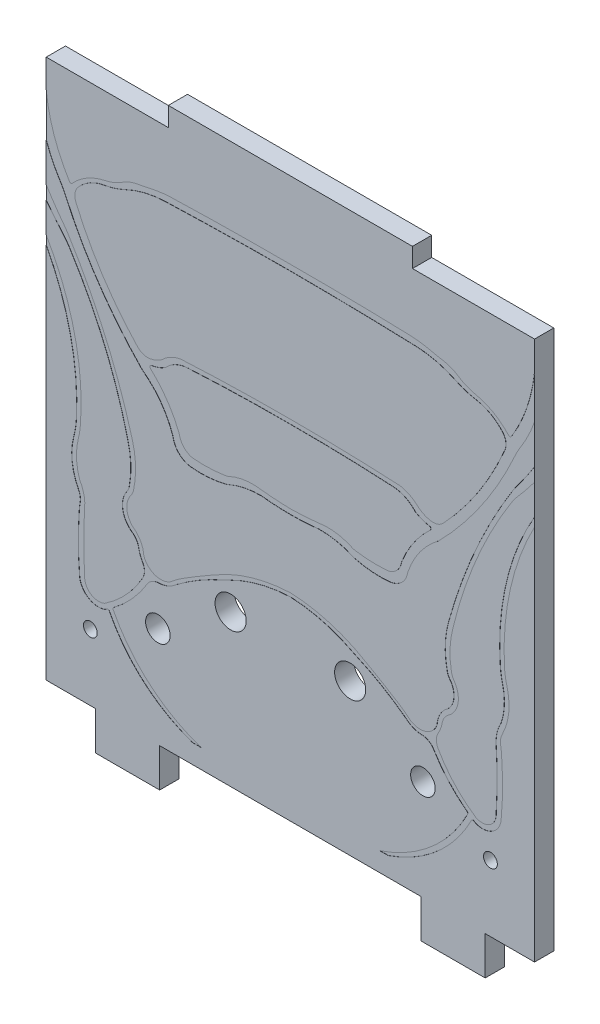
from build123d import *

# Parameters (mm, degrees)
SKETCH_1_W          = 76.2
SKETCH_1_H          = 84.2
EXTRUDE_1_DEPTH     = 3
SKETCH_2_R          = 2.428209478
SKETCH_2_R_2        = 1.917015623
SKETCH_2_R_3        = 1.077135338
CUT_EXTRUDE_2_DEPTH = 0.025
CUT_EXTRUDE_START   = 3
SKETCH_4_R          = 1.077135338
SKETCH_4_R_2        = 1.917015623
SKETCH_4_R_3        = 2.428209478
CUT_EXTRUDE_7_DEPTH = 3
SKETCH_5_W          = 10
SKETCH_5_H          = 3
EXTRUDE_2_DEPTH     = 3
SKETCH_7_W          = 10
SKETCH_7_H          = 3
EXTRUDE_3_DEPTH     = 3
SKETCH_8_W          = 38.1
SKETCH_8_H          = 3
EXTRUDE_4_DEPTH     = 3


with BuildPart() as part:
    # 스케치1 → 보스-돌출1 (new body)
    with BuildSketch(Plane.XY):
        Rectangle(SKETCH_1_W, SKETCH_1_H)
    extrude(amount=EXTRUDE_1_DEPTH)

    # 스케치2 → 컷-돌출2 (cut)
    # profile 1 of 8: a face of its own
    with BuildSketch(Plane.XY.offset(3)):
        with Locations((9.327829639, -18.496567926)):
            Circle(SKETCH_2_R)
    # profile 2 of 8: a face of its own
    with BuildSketch(Plane.XY.offset(3)):
        with Locations((20.679674422, -26.41933731)):
            Circle(SKETCH_2_R_2)
    # profile 3 of 8: a face of its own
    with BuildSketch(Plane.XY.offset(3)):
        with Locations((31.215777243, -31.768084931)):
            Circle(SKETCH_2_R_3)
    # profile 4 of 8: a face of its own
    with BuildSketch(Plane.XY.offset(3)):
        with Locations(Location((-31.215777243, -31.768084931, 0), (0, 0, 180))):
            Circle(SKETCH_2_R_3)
    # profile 5 of 8: a face of its own
    with BuildSketch(Plane.XY.offset(3)):
        with Locations(Location((-20.679674422, -26.41933731, 0), (0, 0, 180))):
            Circle(SKETCH_2_R_2)
    # profile 6 of 8: a face of its own
    with BuildSketch(Plane.XY.offset(3)):
        with Locations(Location((-9.327829639, -18.496567926, 0), (0, 0, 180))):
            Circle(SKETCH_2_R)
    # profile 7 of 8: a face of its own
    with BuildSketch(Plane.XY.offset(3)):
        with BuildLine():
            Line((13.934162196, -39.12111864), (15.263541272, -39.12111864))
            ThreePointArc((15.263541272, -39.12111864), (22.865645143, -34.759396313), (28.262399999, -27.853482765))
            ThreePointArc((28.262399999, -27.853482765), (28.423488973, -27.723083039), (28.62809542, -27.756097399))
            ThreePointArc((28.62809542, -27.756097399), (28.797135117, -27.865708412), (28.967249862, -27.973643426))
            ThreePointArc((28.967249862, -27.973643426), (31.490380119, -27.721302262), (32.881730928, -25.601395357))
            ThreePointArc((32.881730928, -25.601395357), (33.108744036, -21.079343328), (32.950754552, -16.554353956))
            ThreePointArc((32.950754552, -16.554353956), (32.895980591, -16.00403951), (32.817300277, -15.45663145))
            ThreePointArc((32.817300277, -15.45663145), (32.813206672, -14.608618837), (33.075597067, -13.802211104))
            ThreePointArc((33.075597067, -13.802211104), (34.070130402, -10.477777222), (33.804918268, -7.017918884))
            ThreePointArc((33.804918268, -7.017918884), (33.527781174, -5.698147131), (33.39214944, -4.356429395))
            ThreePointArc((33.39214944, -4.356429395), (34.713431323, 8.054397039), (39.727850627, 19.483745124))
            Line((39.727850627, 19.483745124), (41.992619893, 23.55575662))
            ThreePointArc((41.992619893, 23.55575662), (34.600568834, 10.267079087), (32.755117617, -4.826816342))
            ThreePointArc((32.755117617, -4.826816342), (32.879713892, -5.911777007), (33.097060574, -6.982021977))
            ThreePointArc((33.097060574, -6.982021977), (33.375678952, -9.708481541), (32.881730928, -12.404260705))
            ThreePointArc((32.881730928, -12.404260705), (32.233999273, -14.014722003), (32.09318724, -15.744841613))
            ThreePointArc((32.09318724, -15.744841613), (32.253303205, -20.095129768), (32.129656743, -24.446607185))
            ThreePointArc((32.129656743, -24.446607185), (32.112565855, -24.813551729), (32.106094728, -25.180837069))
            ThreePointArc((32.106094728, -25.180837069), (31.079133588, -27.030041589), (28.967249862, -27.149010763))
            ThreePointArc((28.967249862, -27.149010763), (25.632658782, -24.31646706), (23.057554346, -20.779287584))
            ThreePointArc((23.057554346, -20.779287584), (22.782288212, -19.701727619), (23.079898446, -18.630123648))
            ThreePointArc((23.079898446, -18.630123648), (23.43931657, -17.881245852), (23.668574314, -17.082847312))
            ThreePointArc((23.668574314, -17.082847312), (24.042961938, -16.087682138), (24.802627576, -15.343754765))
            ThreePointArc((24.802627576, -15.343754765), (26.17850918, -12.97503464), (25.521446807, -10.315682415))
            ThreePointArc((25.521446807, -10.315682415), (25.289366196, -9.90809014), (25.15078603, -9.459995942))
            ThreePointArc((25.15078603, -9.459995942), (24.911605958, -6.315066283), (25.396890766, -3.198611835))
            ThreePointArc((25.396890766, -3.198611835), (29.045759895, 7.828201443), (34.444593934, 18.112045472))
            ThreePointArc((34.444593934, 18.112045472), (34.993017934, 18.907813694), (35.600366543, 19.659574038))
            ThreePointArc((35.600366543, 19.659574038), (38.496984301, 23.307957319), (41.041801505, 27.209879973))
            Line((41.041801505, 27.209879973), (41.992619893, 32.32513362))
            ThreePointArc((41.992619893, 32.32513362), (39.014754151, 26.373795663), (35.330953955, 20.831618838))
            ThreePointArc((35.330953955, 20.831618838), (35.00586607, 20.382108552), (34.70071855, 19.918830426))
            ThreePointArc((34.70071855, 19.918830426), (28.844648302, 8.874210695), (24.65942459, -2.905478869))
            ThreePointArc((24.65942459, -2.905478869), (24.160296769, -6.273037799), (24.483825739, -9.661977269))
            ThreePointArc((24.483825739, -9.661977269), (24.634881043, -10.109037278), (24.879456363, -10.512600495))
            ThreePointArc((24.879456363, -10.512600495), (25.515004835, -12.604131615), (24.616277897, -14.596796708))
            ThreePointArc((24.616277897, -14.596796708), (23.384450935, -15.925251516), (22.875319245, -17.663921917))
            ThreePointArc((22.875319245, -17.663921917), (20.968006599, -19.460386052), (18.412391183, -18.882497854))
            ThreePointArc((18.412391183, -18.882497854), (17.683785302, -18.299807803), (16.914369508, -17.772177666))
            ThreePointArc((16.914369508, -17.772177666), (13.670902901, -15.798638297), (10.359467104, -13.941402117))
            ThreePointArc((10.359467104, -13.941402117), (10.066751736, -13.788861516), (9.770170987, -13.643979561))
            ThreePointArc((9.770170987, -13.643979561), (5.005772807, -11.951200695), (0, -11.23900064))
            ThreePointArc((0, -11.23900064), (-5.005772807, -11.951200695), (-9.770170987, -13.643979561))
            ThreePointArc((-9.770170987, -13.643979561), (-10.066751736, -13.788861516), (-10.359467104, -13.941402117))
            ThreePointArc((-10.359467104, -13.941402117), (-13.670902901, -15.798638297), (-16.914369508, -17.772177666))
            ThreePointArc((-16.914369508, -17.772177666), (-17.683785302, -18.299807803), (-18.412391183, -18.882497854))
            ThreePointArc((-18.412391183, -18.882497854), (-20.968006599, -19.460386052), (-22.875319245, -17.663921917))
            ThreePointArc((-22.875319245, -17.663921917), (-23.384450935, -15.925251516), (-24.616277897, -14.596796708))
            ThreePointArc((-24.616277897, -14.596796708), (-25.515004835, -12.604131615), (-24.879456363, -10.512600495))
            ThreePointArc((-24.879456363, -10.512600495), (-24.634881043, -10.109037278), (-24.483825739, -9.661977269))
            ThreePointArc((-24.483825739, -9.661977269), (-24.160296769, -6.273037799), (-24.65942459, -2.905478869))
            ThreePointArc((-24.65942459, -2.905478869), (-28.844648302, 8.874210695), (-34.70071855, 19.918830426))
            ThreePointArc((-34.70071855, 19.918830426), (-35.00586607, 20.382108552), (-35.330953955, 20.831618838))
            ThreePointArc((-35.330953955, 20.831618838), (-39.014754151, 26.373795663), (-41.992619893, 32.32513362))
            Line((-41.992619893, 32.32513362), (-41.041801505, 27.209879973))
            ThreePointArc((-41.041801505, 27.209879973), (-38.496984301, 23.307957319), (-35.600366543, 19.659574038))
            ThreePointArc((-35.600366543, 19.659574038), (-34.993017934, 18.907813694), (-34.444593934, 18.112045472))
            ThreePointArc((-34.444593934, 18.112045472), (-29.045759895, 7.828201443), (-25.396890766, -3.198611835))
            ThreePointArc((-25.396890766, -3.198611835), (-24.911605958, -6.315066283), (-25.15078603, -9.459995942))
            ThreePointArc((-25.15078603, -9.459995942), (-25.289366196, -9.90809014), (-25.521446807, -10.315682415))
            ThreePointArc((-25.521446807, -10.315682415), (-26.17850918, -12.97503464), (-24.802627576, -15.343754765))
            ThreePointArc((-24.802627576, -15.343754765), (-24.042961938, -16.087682138), (-23.668574314, -17.082847312))
            ThreePointArc((-23.668574314, -17.082847312), (-23.43931657, -17.881245852), (-23.079898446, -18.630123648))
            ThreePointArc((-23.079898446, -18.630123648), (-22.782288212, -19.701727619), (-23.057554346, -20.779287584))
            ThreePointArc((-23.057554346, -20.779287584), (-25.632658782, -24.31646706), (-28.967249862, -27.149010763))
            ThreePointArc((-28.967249862, -27.149010763), (-31.079133588, -27.030041589), (-32.106094728, -25.180837069))
            ThreePointArc((-32.106094728, -25.180837069), (-32.112565855, -24.813551729), (-32.129656743, -24.446607185))
            ThreePointArc((-32.129656743, -24.446607185), (-32.253303205, -20.095129768), (-32.09318724, -15.744841613))
            ThreePointArc((-32.09318724, -15.744841613), (-32.233999273, -14.014722003), (-32.881730928, -12.404260705))
            ThreePointArc((-32.881730928, -12.404260705), (-33.375678952, -9.708481541), (-33.097060574, -6.982021977))
            ThreePointArc((-33.097060574, -6.982021977), (-32.879713892, -5.911777007), (-32.755117617, -4.826816342))
            ThreePointArc((-32.755117617, -4.826816342), (-34.600568834, 10.267079087), (-41.992619893, 23.55575662))
            Line((-41.992619893, 23.55575662), (-39.727850627, 19.483745124))
            ThreePointArc((-39.727850627, 19.483745124), (-34.713431323, 8.054397039), (-33.39214944, -4.356429395))
            ThreePointArc((-33.39214944, -4.356429395), (-33.527781174, -5.698147131), (-33.804918268, -7.017918884))
            ThreePointArc((-33.804918268, -7.017918884), (-34.070130402, -10.477777222), (-33.075597067, -13.802211104))
            ThreePointArc((-33.075597067, -13.802211104), (-32.813206672, -14.608618837), (-32.817300277, -15.45663145))
            ThreePointArc((-32.817300277, -15.45663145), (-32.895980591, -16.00403951), (-32.950754552, -16.554353956))
            ThreePointArc((-32.950754552, -16.554353956), (-33.108744036, -21.079343328), (-32.881730928, -25.601395357))
            ThreePointArc((-32.881730928, -25.601395357), (-31.490380119, -27.721302262), (-28.967249862, -27.973643426))
            ThreePointArc((-28.967249862, -27.973643426), (-28.797135117, -27.865708412), (-28.62809542, -27.756097399))
            ThreePointArc((-28.62809542, -27.756097399), (-28.423488973, -27.723083039), (-28.262399999, -27.853482765))
            ThreePointArc((-28.262399999, -27.853482765), (-22.865645143, -34.759396313), (-15.263541272, -39.12111864))
            Line((-15.263541272, -39.12111864), (-13.934162196, -39.12111864))
            ThreePointArc((-13.934162196, -39.12111864), (-21.958332926, -34.586150291), (-27.655887351, -27.341074213))
            ThreePointArc((-27.655887351, -27.341074213), (-27.677002931, -27.168252577), (-27.581870364, -27.022434266))
            ThreePointArc((-27.581870364, -27.022434266), (-24.68833296, -24.385208433), (-22.352321726, -21.243462053))
            ThreePointArc((-22.352321726, -21.243462053), (-21.591723797, -20.494343647), (-20.565191877, -20.201222831))
            ThreePointArc((-20.565191877, -20.201222831), (-19.279701769, -19.952749498), (-18.140999604, -19.306544272))
            ThreePointArc((-18.140999604, -19.306544272), (-17.965542443, -19.167543267), (-17.787662658, -19.031656266))
            ThreePointArc((-17.787662658, -19.031656266), (-14.261601321, -16.688734985), (-10.491646116, -14.762644011))
            ThreePointArc((-10.491646116, -14.762644011), (-10.126331657, -14.594618163), (-9.766519623, -14.415111506))
            ThreePointArc((-9.766519623, -14.415111506), (-5.025755107, -12.578481537), (0, -11.810468876))
            ThreePointArc((0, -11.810468876), (5.025755107, -12.578481537), (9.766519623, -14.415111506))
            ThreePointArc((9.766519623, -14.415111506), (10.126331657, -14.594618163), (10.491646116, -14.762644011))
            ThreePointArc((10.491646116, -14.762644011), (14.261601321, -16.688734985), (17.787662658, -19.031656266))
            ThreePointArc((17.787662658, -19.031656266), (17.965542443, -19.167543267), (18.140999604, -19.306544272))
            ThreePointArc((18.140999604, -19.306544272), (19.279701769, -19.952749498), (20.565191877, -20.201222831))
            ThreePointArc((20.565191877, -20.201222831), (21.591723797, -20.494343647), (22.352321726, -21.243462053))
            ThreePointArc((22.352321726, -21.243462053), (24.68833296, -24.385208433), (27.581870364, -27.022434266))
            ThreePointArc((27.581870364, -27.022434266), (27.677002931, -27.168252577), (27.655887351, -27.341074213))
            ThreePointArc((27.655887351, -27.341074213), (21.958332926, -34.586150291), (13.934162196, -39.12111864))
        make_face()
    # profile 8 of 8: a face of its own
    with BuildSketch(Plane.XY.offset(3)):
        with BuildLine():
            Line((39.178056075, 35.90612314), (38.238778612, 40.015630812))
            ThreePointArc((38.238778612, 40.015630812), (37.237602441, 33.294390869), (34.465709063, 27.090035366))
            ThreePointArc((34.465709063, 27.090035366), (34.272868191, 26.971191606), (34.061847081, 27.053541665))
            ThreePointArc((34.061847081, 27.053541665), (31.684211095, 28.959938129), (28.830964112, 30.030677131))
            ThreePointArc((28.830964112, 30.030677131), (27.493850466, 30.440134651), (26.260185446, 31.098616983))
            ThreePointArc((26.260185446, 31.098616983), (25.06137721, 31.723038967), (23.757552781, 32.079530003))
            ThreePointArc((23.757552781, 32.079530003), (22.848684084, 32.242990095), (21.946171984, 32.438523768))
            ThreePointArc((21.946171984, 32.438523768), (20.267541795, 32.746157945), (18.566638745, 32.885322999))
            ThreePointArc((18.566638745, 32.885322999), (9.284479297, 33.098398427), (0, 33.146661578))
            ThreePointArc((0, 33.146661578), (-9.284479297, 33.098398427), (-18.566638745, 32.885322999))
            ThreePointArc((-18.566638745, 32.885322999), (-20.267541795, 32.746157945), (-21.946171984, 32.438523768))
            ThreePointArc((-21.946171984, 32.438523768), (-22.848684084, 32.242990095), (-23.757552781, 32.079530003))
            ThreePointArc((-23.757552781, 32.079530003), (-25.06137721, 31.723038967), (-26.260185446, 31.098616983))
            ThreePointArc((-26.260185446, 31.098616983), (-27.493850466, 30.440134651), (-28.830964112, 30.030677131))
            ThreePointArc((-28.830964112, 30.030677131), (-31.684211095, 28.959938129), (-34.061847081, 27.053541665))
            ThreePointArc((-34.061847081, 27.053541665), (-34.272868191, 26.971191606), (-34.465709063, 27.090035366))
            ThreePointArc((-34.465709063, 27.090035366), (-37.237602441, 33.294390869), (-38.238778612, 40.015630812))
            Line((-38.238778612, 40.015630812), (-39.178056075, 35.90612314))
            ThreePointArc((-39.178056075, 35.90612314), (-38.117521072, 30.965450318), (-35.924822688, 26.412752631))
            ThreePointArc((-35.924822688, 26.412752631), (-35.458020326, 25.618335098), (-35.050045415, 24.792163122))
            ThreePointArc((-35.050045415, 24.792163122), (-29.869009498, 15.541202222), (-23.146148346, 7.342022465))
            ThreePointArc((-23.146148346, 7.342022465), (-20.256712885, 4.441846825), (-18.362433719, 0.812582097))
            ThreePointArc((-18.362433719, 0.812582097), (-18.320323487, 0.674699083), (-18.287509325, 0.534313086))
            ThreePointArc((-18.287509325, 0.534313086), (-17.396143119, -1.118509818), (-15.730036521, -1.984792722))
            ThreePointArc((-15.730036521, -1.984792722), (-15.648837961, -1.998067769), (-15.567192559, -2.008239372))
            ThreePointArc((-15.567192559, -2.008239372), (-12.767938985, -2.047628744), (-10.007619452, -1.5807153))
            ThreePointArc((-10.007619452, -1.5807153), (-9.842529356, -1.52993708), (-9.682026638, -1.466124503))
            ThreePointArc((-9.682026638, -1.466124503), (-7.165467012, -0.662279722), (-4.534495742, -0.423053973))
            ThreePointArc((-4.534495742, -0.423053973), (-4.442070348, -0.426752649), (-4.349888209, -0.43440686))
            ThreePointArc((-4.349888209, -0.43440686), (-2.177884868, -0.609117994), (0, -0.67940308))
            ThreePointArc((0, -0.67940308), (2.177884868, -0.609117994), (4.349888209, -0.43440686))
            ThreePointArc((4.349888209, -0.43440686), (4.442070348, -0.426752649), (4.534495742, -0.423053973))
            ThreePointArc((4.534495742, -0.423053973), (7.165467012, -0.662279722), (9.682026638, -1.466124503))
            ThreePointArc((9.682026638, -1.466124503), (9.842529356, -1.52993708), (10.007619452, -1.5807153))
            ThreePointArc((10.007619452, -1.5807153), (12.767938985, -2.047628744), (15.567192559, -2.008239372))
            ThreePointArc((15.567192559, -2.008239372), (15.648837961, -1.998067769), (15.730036521, -1.984792722))
            ThreePointArc((15.730036521, -1.984792722), (17.396143119, -1.118509818), (18.287509325, 0.534313086))
            ThreePointArc((18.287509325, 0.534313086), (18.320323487, 0.674699083), (18.362433719, 0.812582097))
            ThreePointArc((18.362433719, 0.812582097), (20.256712885, 4.441846825), (23.146148346, 7.342022465))
            ThreePointArc((23.146148346, 7.342022465), (29.869009498, 15.541202222), (35.050045415, 24.792163122))
            ThreePointArc((35.050045415, 24.792163122), (35.458020326, 25.618335098), (35.924822688, 26.412752631))
            ThreePointArc((35.924822688, 26.412752631), (38.117521072, 30.965450318), (39.178056075, 35.90612314))
        make_face()
        with BuildLine():
            ThreePointArc((15.614243413, 11.125400822), (15.77165125, 11.117669685), (15.929142902, 11.111892419))
            ThreePointArc((15.929142902, 11.111892419), (17.893540483, 10.639242678), (19.505125767, 9.420617016))
            ThreePointArc((19.505125767, 9.420617016), (20.57853202, 8.911759006), (21.725416795, 8.602254937))
            ThreePointArc((21.725416795, 8.602254937), (21.925189234, 8.423501162), (21.85345164, 8.165207421))
            ThreePointArc((21.85345164, 8.165207421), (19.273573916, 5.2012496), (17.406635236, 1.743597942))
            ThreePointArc((17.406635236, 1.743597942), (17.343331278, 1.564994151), (17.295931698, 1.381527574))
            ThreePointArc((17.295931698, 1.381527574), (16.586164641, 0.06938014), (15.277777689, -0.647295341))
            ThreePointArc((15.277777689, -0.647295341), (12.710667107, -0.724919353), (10.154071855, -0.480168581))
            ThreePointArc((10.154071855, -0.480168581), (9.866489519, -0.413839315), (9.590640062, -0.308909587))
            ThreePointArc((9.590640062, -0.308909587), (7.091051791, 0.422588682), (4.486748577, 0.397369576))
            ThreePointArc((4.486748577, 0.397369576), (4.426057671, 0.388651337), (4.365143673, 0.381660014))
            ThreePointArc((4.365143673, 0.381660014), (2.185115773, 0.203183137), (0, 0.104975736))
            ThreePointArc((0, 0.104975736), (-2.185115773, 0.203183137), (-4.365143673, 0.381660014))
            ThreePointArc((-4.365143673, 0.381660014), (-4.426057671, 0.388651337), (-4.486748577, 0.397369576))
            ThreePointArc((-4.486748577, 0.397369576), (-7.091051791, 0.422588682), (-9.590640062, -0.308909587))
            ThreePointArc((-9.590640062, -0.308909587), (-9.866489519, -0.413839315), (-10.154071855, -0.480168581))
            ThreePointArc((-10.154071855, -0.480168581), (-12.710667107, -0.724919353), (-15.277777689, -0.647295341))
            ThreePointArc((-15.277777689, -0.647295341), (-16.586164641, 0.06938014), (-17.295931698, 1.381527574))
            ThreePointArc((-17.295931698, 1.381527574), (-17.343331278, 1.564994151), (-17.406635236, 1.743597942))
            ThreePointArc((-17.406635236, 1.743597942), (-19.273573916, 5.2012496), (-21.85345164, 8.165207421))
            ThreePointArc((-21.85345164, 8.165207421), (-21.925189234, 8.423501162), (-21.725416795, 8.602254937))
            ThreePointArc((-21.725416795, 8.602254937), (-20.57853202, 8.911759006), (-19.505125767, 9.420617016))
            ThreePointArc((-19.505125767, 9.420617016), (-17.893540483, 10.639242678), (-15.929142902, 11.111892419))
            ThreePointArc((-15.929142902, 11.111892419), (-15.77165125, 11.117669685), (-15.614243413, 11.125400822))
            ThreePointArc((-15.614243413, 11.125400822), (-7.810087991, 11.441031157), (0, 11.524636939))
            ThreePointArc((0, 11.524636939), (7.810087991, 11.441031157), (15.614243413, 11.125400822))
        make_face(mode=Mode.SUBTRACT)
        with BuildLine():
            ThreePointArc((33.460818377, 24.765263312), (29.302320444, 17.001169339), (23.850055853, 10.084011606))
            ThreePointArc((23.850055853, 10.084011606), (22.956794993, 9.514576109), (21.90019882, 9.4385743))
            ThreePointArc((21.90019882, 9.4385743), (20.914273241, 9.736261817), (20.024431154, 10.254767519))
            ThreePointArc((20.024431154, 10.254767519), (18.699311041, 11.240539383), (17.138108423, 11.779367617))
            ThreePointArc((17.138108423, 11.779367617), (8.572027334, 12.114906679), (0, 12.218246305))
            ThreePointArc((0, 12.218246305), (-8.572027334, 12.114906679), (-17.138108423, 11.779367617))
            ThreePointArc((-17.138108423, 11.779367617), (-18.699311041, 11.240539383), (-20.024431154, 10.254767519))
            ThreePointArc((-20.024431154, 10.254767519), (-20.914273241, 9.736261817), (-21.90019882, 9.4385743))
            ThreePointArc((-21.90019882, 9.4385743), (-22.956794993, 9.514576109), (-23.850055853, 10.084011606))
            ThreePointArc((-23.850055853, 10.084011606), (-29.302320444, 17.001169339), (-33.460818377, 24.765263312))
            ThreePointArc((-33.460818377, 24.765263312), (-33.60816698, 25.949678866), (-33.103737367, 27.031391667))
            ThreePointArc((-33.103737367, 27.031391667), (-31.263406641, 28.526198714), (-29.026407855, 29.311756938))
            ThreePointArc((-29.026407855, 29.311756938), (-27.38173912, 29.707343044), (-25.809054051, 30.330307964))
            ThreePointArc((-25.809054051, 30.330307964), (-22.775824327, 31.418745906), (-19.583928862, 31.862573623))
            ThreePointArc((-19.583928862, 31.862573623), (-9.793454422, 32.12572468), (0, 32.230073683))
            ThreePointArc((0, 32.230073683), (9.793454422, 32.12572468), (19.583928862, 31.862573623))
            ThreePointArc((19.583928862, 31.862573623), (22.775824327, 31.418745906), (25.809054051, 30.330307964))
            ThreePointArc((25.809054051, 30.330307964), (27.38173912, 29.707343044), (29.026407855, 29.311756938))
            ThreePointArc((29.026407855, 29.311756938), (31.263406641, 28.526198714), (33.103737367, 27.031391667))
            ThreePointArc((33.103737367, 27.031391667), (33.60816698, 25.949678866), (33.460818377, 24.765263312))
        make_face(mode=Mode.SUBTRACT)
    extrude(amount=-CUT_EXTRUDE_2_DEPTH, mode=Mode.SUBTRACT)

    # 스케치4 → 컷-돌출7 (cut)
    with BuildSketch(Plane.XY.offset(CUT_EXTRUDE_START)):
        with Locations((31.215777243, -31.768084931)):
            Circle(SKETCH_4_R)
        with Locations((20.679674422, -26.41933731)):
            Circle(SKETCH_4_R_2)
        with Locations((9.327829639, -18.496567926)):
            Circle(SKETCH_4_R_3)
        with Locations((-31.215777243, -31.768084931)):
            Circle(SKETCH_4_R)
        with Locations((-20.679674422, -26.41933731)):
            Circle(SKETCH_4_R_2)
        with Locations((-9.327829639, -18.496567926)):
            Circle(SKETCH_4_R_3)
    extrude(amount=-CUT_EXTRUDE_7_DEPTH, mode=Mode.SUBTRACT)

    # 스케치5 → 보스-돌출2 (add)
    with BuildSketch(Plane(origin=(0, 0, 0), x_dir=(-1, 0, 0), z_dir=(0, 0, -1))):
        with Locations((25.4, -43.6)):
            Rectangle(SKETCH_5_W, SKETCH_5_H)
        with Locations((-25.4, -43.6)):
            Rectangle(SKETCH_5_W, SKETCH_5_H)
    extrude(amount=-EXTRUDE_2_DEPTH)

    # 스케치7 → 보스-돌출3 (add)
    with BuildSketch(Plane.XZ.offset(45.1)):
        with Locations((25.4, 1.5)):
            Rectangle(SKETCH_7_W, SKETCH_7_H)
        with Locations((-25.4, 1.5)):
            Rectangle(SKETCH_7_W, SKETCH_7_H)
    extrude(amount=EXTRUDE_3_DEPTH)

    # 스케치8 → 보스-돌출4 (add)
    with BuildSketch(Plane.XY.offset(3)):
        with Locations((0, 43.6)):
            Rectangle(SKETCH_8_W, SKETCH_8_H)
    extrude(amount=-EXTRUDE_4_DEPTH)


solid = part.part
